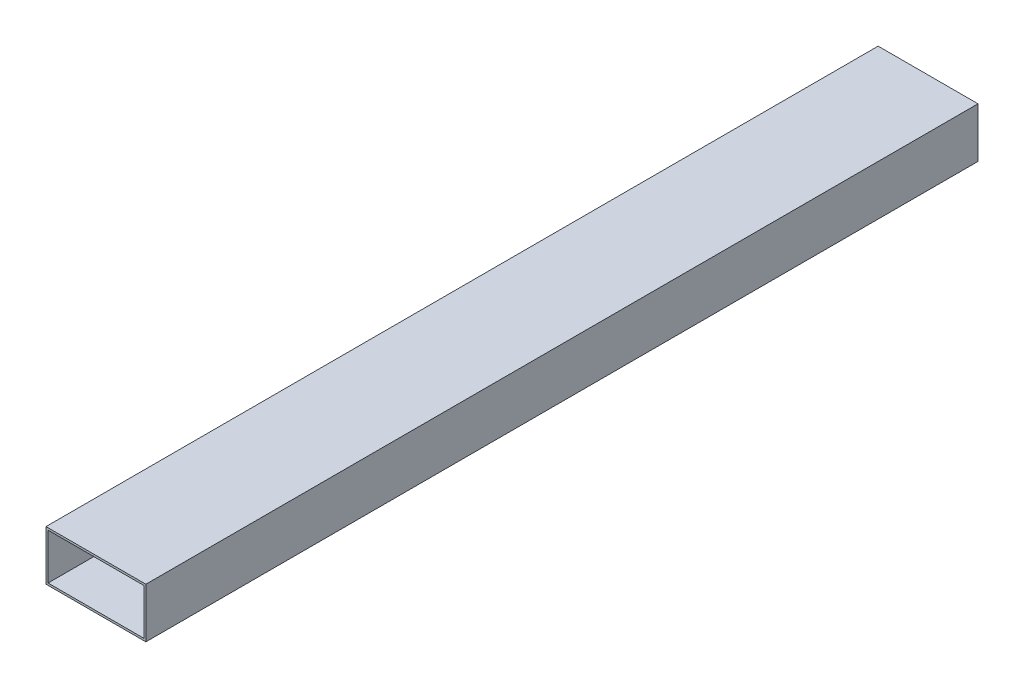
from build123d import *

# Parameters (mm, degrees)
SKETCH1_W           = 48
SKETCH1_H           = 24
SKETCH1_W_2         = 46
SKETCH1_H_2         = 22
BOSS_EXTRUDE1_DEPTH = 400


with BuildPart() as part:
    # Sketch1 → Boss-Extrude1 (new body)
    with BuildSketch(Plane.XY):
        Rectangle(SKETCH1_W, SKETCH1_H)
        Rectangle(SKETCH1_W_2, SKETCH1_H_2, mode=Mode.SUBTRACT)
    extrude(amount=BOSS_EXTRUDE1_DEPTH)


solid = part.part
